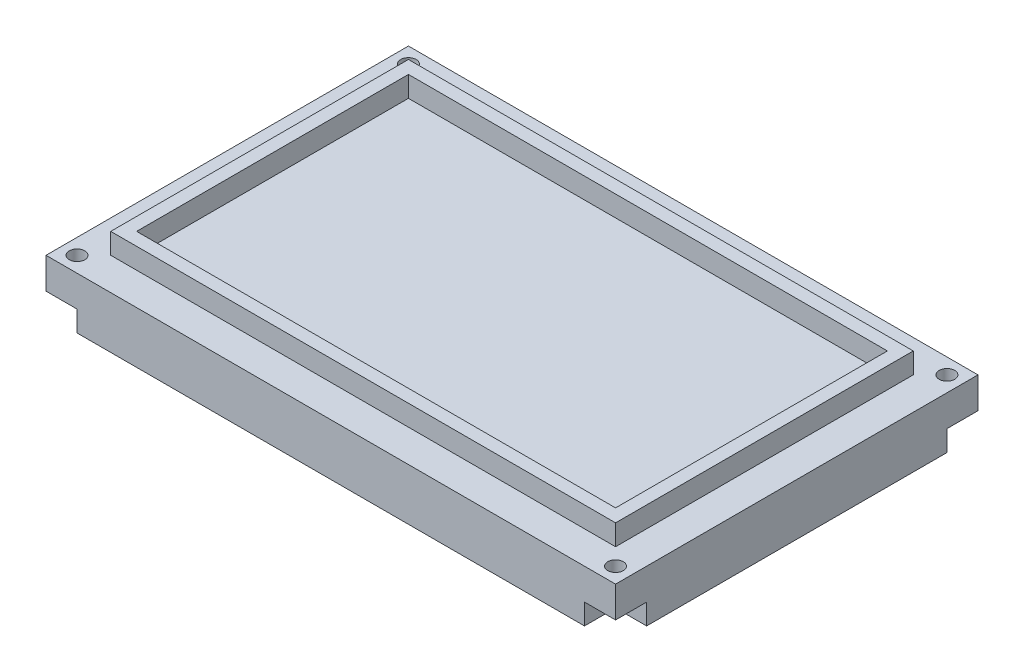
from build123d import *

# Parameters (mm, degrees)
SKETCH1_W               = 139.7
SKETCH1_H               = 88.9
BOSS_EXTRUDE1_DEPTH     = 12.7
SKETCH4_R               = 1.905
CUT_EXTRUDE1_DEPTH      = 84.762252835
MIRROR2_COPY_1_SKETCH_R = 1.905
MIRROR2_COPY_1_DEPTH    = 84.762252835
SKETCH5_W               = 123.825
SKETCH5_H               = 73.025
SKETCH5_W_2             = 117.475
SKETCH5_H_2             = 66.675
BOSS_EXTRUDE2_DEPTH     = 5.08
SKETCH6_W               = 7.62
SKETCH6_H               = 7.62
CUT_EXTRUDE2_DEPTH      = 5.08
MIRROR4_COPY_1_SKETCH_W = 7.62
MIRROR4_COPY_1_SKETCH_H = 7.62
MIRROR4_COPY_1_DEPTH    = 5.08


with BuildPart() as part:
    # Sketch1 → Boss-Extrude1 (new body)
    with BuildSketch(Plane(origin=(0, 0, 0), x_dir=(1, 0, 0), z_dir=(0, 1, 0))):
        Rectangle(SKETCH1_W, SKETCH1_H)
    extrude(amount=BOSS_EXTRUDE1_DEPTH)

    # Sketch4 → Cut-Extrude1 (cut, through all)
    with BuildSketch(Plane(origin=(0, 12.7, 0), x_dir=(1, 0, 0), z_dir=(0, 1, 0))):
        with Locations(Location((-66.04, 40.64, 0), (0, 0, 270))):
            Circle(SKETCH4_R)
    cut_extrude1 = extrude(amount=-CUT_EXTRUDE1_DEPTH, mode=Mode.SUBTRACT)

    # Mirror1: Cut-Extrude1 across plane
    add(cut_extrude1.mirror(Plane(origin=(0, 0, 0), x_dir=(0, 0, 1), z_dir=(1, 0, 0))), mode=Mode.SUBTRACT)

    # Mirror2: Cut-Extrude1 across plane
    add(cut_extrude1.mirror(Plane.XY), mode=Mode.SUBTRACT)

    # Mirror2 copy 1 sketch → Mirror2 copy 1 (cut, through all)
    with BuildSketch(Plane(origin=(0, 12.7, 0), x_dir=(-1, 0, 0), z_dir=(0, 1, 0))):
        with Locations(Location((-66.04, 40.64, 0), (0, 0, 270))):
            Circle(MIRROR2_COPY_1_SKETCH_R)
    extrude(amount=-MIRROR2_COPY_1_DEPTH, mode=Mode.SUBTRACT)

    # Sketch5 → Boss-Extrude2 (add)
    with BuildSketch(Plane(origin=(0, 12.7, 0), x_dir=(1, 0, 0), z_dir=(0, 1, 0))):
        Rectangle(SKETCH5_W, SKETCH5_H)
        Rectangle(SKETCH5_W_2, SKETCH5_H_2, mode=Mode.SUBTRACT)
    extrude(amount=BOSS_EXTRUDE2_DEPTH)

    # Sketch6 → Cut-Extrude2 (cut)
    with BuildSketch(Plane.XZ):
        with Locations((-66.04, 40.64)):
            Rectangle(SKETCH6_W, SKETCH6_H)
    cut_extrude2 = extrude(amount=-CUT_EXTRUDE2_DEPTH, mode=Mode.SUBTRACT)

    # Mirror3: Cut-Extrude2 across plane
    add(cut_extrude2.mirror(Plane(origin=(0, 0, 0), x_dir=(0, 0, 1), z_dir=(1, 0, 0))), mode=Mode.SUBTRACT)

    # Mirror4: Cut-Extrude2 across plane
    add(cut_extrude2.mirror(Plane.XY), mode=Mode.SUBTRACT)

    # Mirror4 copy 1 sketch → Mirror4 copy 1 (cut)
    with BuildSketch(Plane(origin=(0, 0, 0), x_dir=(-1, 0, 0), z_dir=(0, -1, 0))):
        with Locations((-66.04, 40.64)):
            Rectangle(MIRROR4_COPY_1_SKETCH_W, MIRROR4_COPY_1_SKETCH_H)
    extrude(amount=-MIRROR4_COPY_1_DEPTH, mode=Mode.SUBTRACT)


solid = part.part
